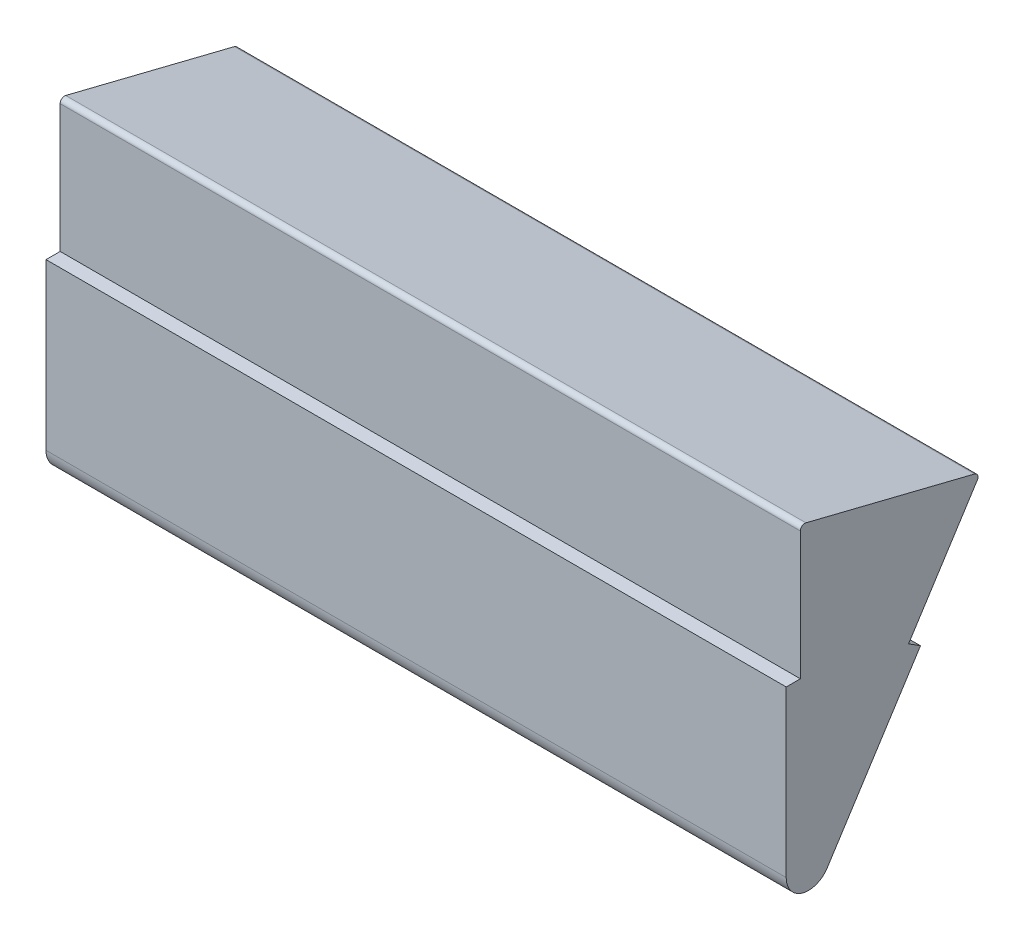
from build123d import *

# Parameters (mm, degrees)
BOSS_EXTRUDE1_DEPTH = 166.124


with BuildPart() as part:
    # Sketch1 → Boss-Extrude1 (new body)
    with BuildSketch(Plane(origin=(0, 0, 0), x_dir=(0, 0, -1), z_dir=(1, 0, 0))):
        with BuildLine():
            Line((0, 35), (3.175, 35))
            Line((3.175, 35), (3.175, 63.720329141))
            ThreePointArc((3.175, 63.720329141), (3.559257641, 64.508276695), (4.416722694, 64.690674512))
            Line((4.416722694, 64.690674512), (42.283933187, 55.257575303))
            ThreePointArc((42.283933187, 55.257575303), (42.971366415, 54.656918005), (42.88448418, 53.748179809))
            Line((42.88448418, 53.748179809), (27.463573236, 29.652781316))
            Line((27.463573236, 29.652781316), (30.137792194, 27.941297175))
            Line((30.137792194, 27.941297175), (9.211368438, -4.756545468))
            ThreePointArc((9.211368438, -4.756545468), (3.595870766, -6.860088565), (0, -2.061294853))
            Line((0, -2.061294853), (0, 35))
        make_face()
    extrude(amount=BOSS_EXTRUDE1_DEPTH)


solid = part.part
